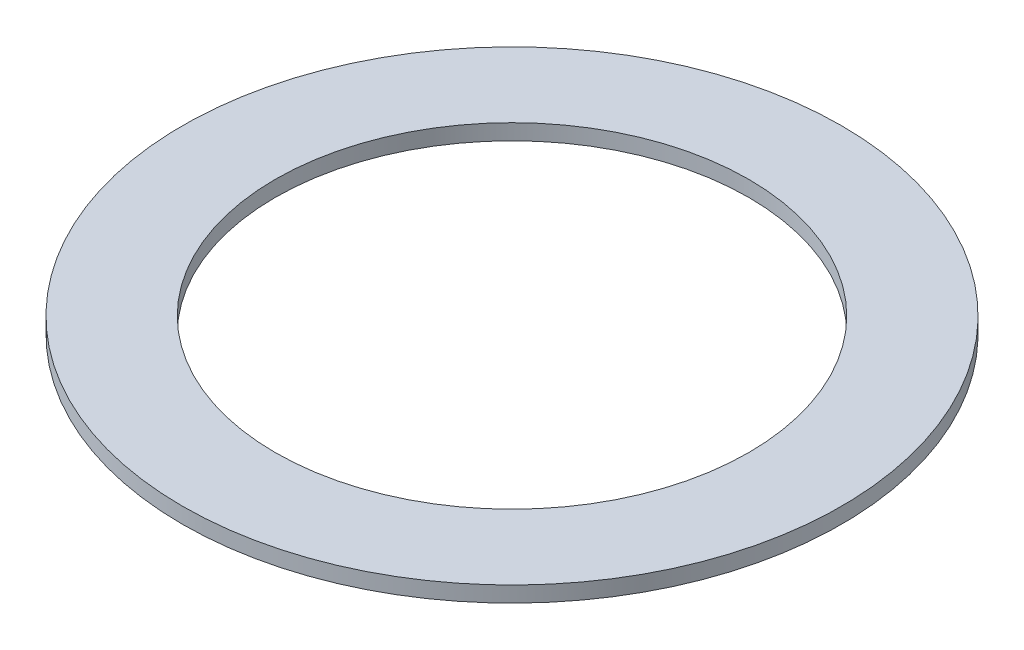
from build123d import *

# Parameters (mm, degrees)
SKETCH1_R           = 31.5
SKETCH1_R_2         = 22.625
BOSS_EXTRUDE1_DEPTH = 1.5


with BuildPart() as part:
    # Sketch1 → Boss-Extrude1 (new body)
    with BuildSketch(Plane(origin=(0, 0, 0), x_dir=(1, 0, 0), z_dir=(0, 1, 0))):
        with Locations(Location((0, 0, 0), (0, 0, 270))):
            Circle(SKETCH1_R)
        with Locations(Location((0, 0, 0), (0, 0, 270))):
            Circle(SKETCH1_R_2, mode=Mode.SUBTRACT)
    extrude(amount=BOSS_EXTRUDE1_DEPTH)


solid = part.part
